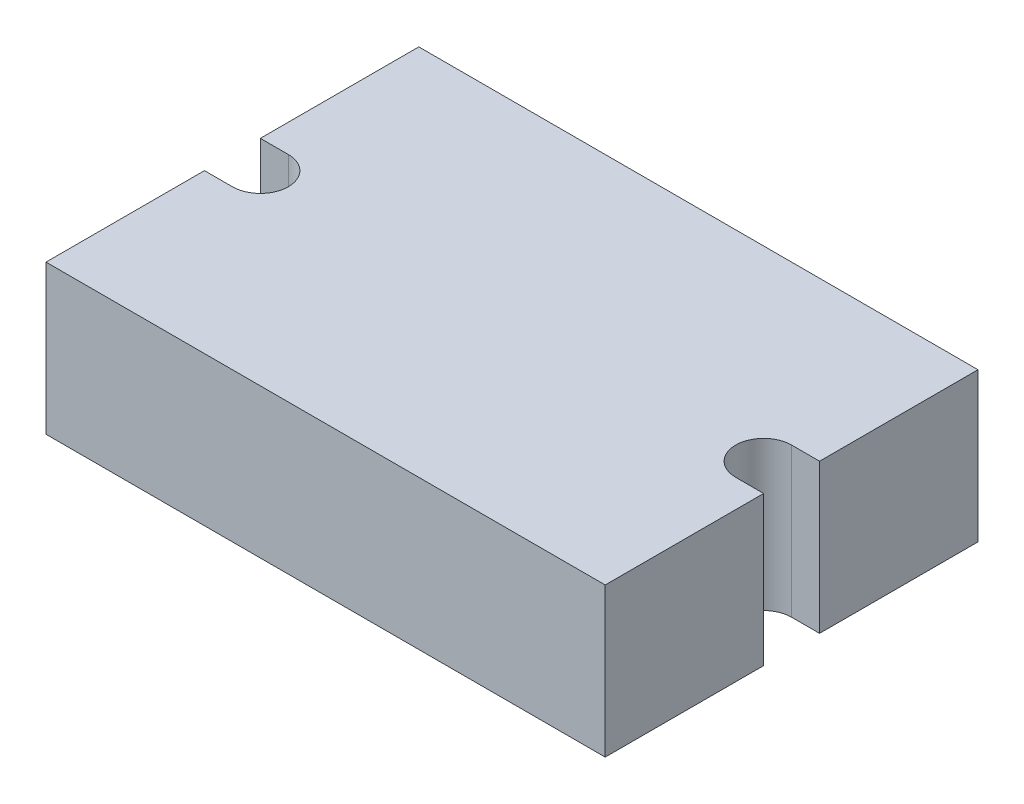
from build123d import *

# Parameters (mm, degrees)
DODANIE_WYCI_GNI_CIE1_DEPTH = 8


with BuildPart() as part:
    # Szkic1 → Dodanie-wyciągnięcie1 (new body)
    with BuildSketch(Plane(origin=(0, 0, 0), x_dir=(1, 0, 0), z_dir=(0, 1, 0))):
        with BuildLine():
            Line((0, 0), (30, 0))
            Line((30, 0), (30, 8.5))
            Line((30, 8.5), (28.5, 8.5))
            ThreePointArc((28.5, 8.5), (27, 10), (28.5, 11.5))
            Line((28.5, 11.5), (30, 11.5))
            Line((30, 11.5), (30, 20))
            Line((30, 20), (0, 20))
            Line((0, 20), (0, 11.5))
            Line((0, 11.5), (1.5, 11.5))
            ThreePointArc((1.5, 11.5), (3, 10), (1.5, 8.5))
            Line((1.5, 8.5), (0, 8.5))
            Line((0, 8.5), (0, 0))
        make_face()
    extrude(amount=DODANIE_WYCI_GNI_CIE1_DEPTH)


solid = part.part
